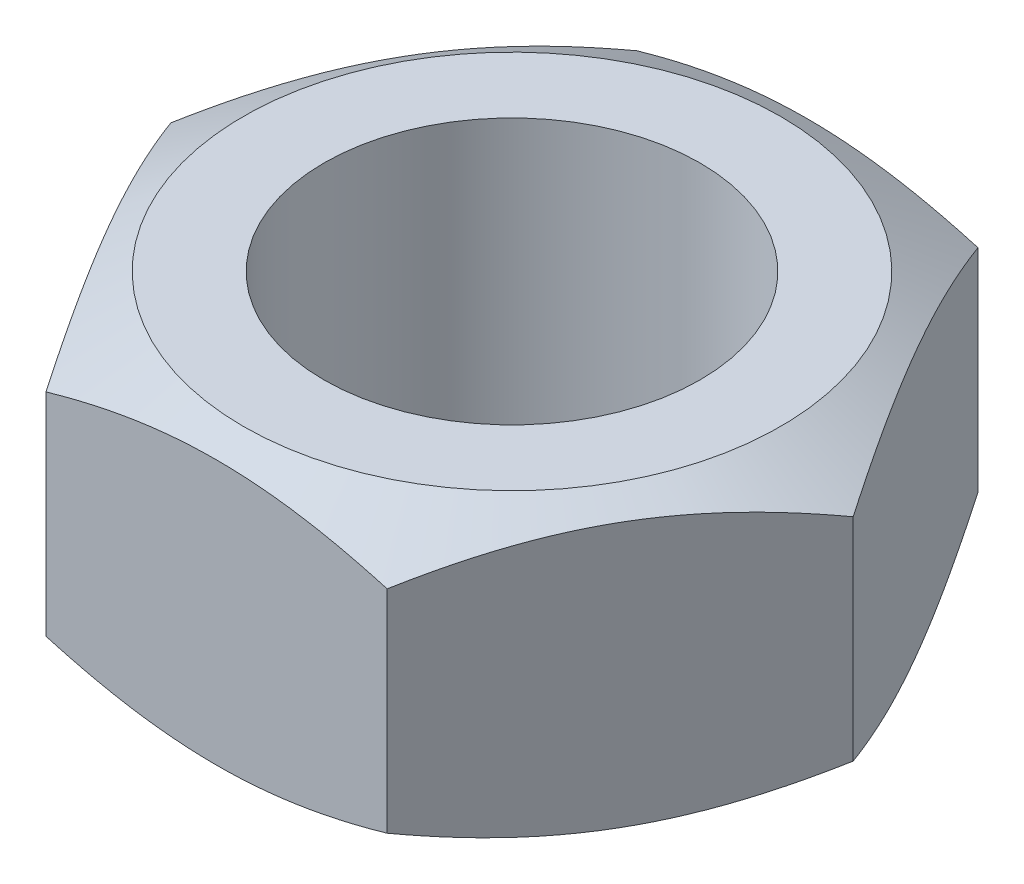
from build123d import *

# Parameters (mm, degrees)
SALIENTE_EXTRUIR6_DEPTH = 5.5
CROQUIS6_R              = 7
CORTAR_EXTRUIR1_DEPTH   = 11
CROQUIS10_OUTSIDE_W     = 69.118
CROQUIS10_OUTSIDE_H     = 65.714
CROQUIS10_OUTSIDE_R     = 10
CORTAR_EXTRUIR2_DEPTH   = 10
CORTAR_EXTRUIR2_DRAFT   = -60
CROQUIS11_OUTSIDE_W     = 69.118
CROQUIS11_OUTSIDE_H     = 65.714
CROQUIS11_OUTSIDE_R     = 10
CORTAR_EXTRUIR3_DEPTH   = 10
CORTAR_EXTRUIR3_DRAFT   = -60


with BuildPart() as part:
    # Croquis5 → Saliente-Extruir6 (new, symmetric)
    with BuildSketch(Plane(origin=(0, 0, 0), x_dir=(1, 0, 0), z_dir=(0, 1, 0))):
        Polygon((12.701705922, 0), (6.350852961, 11), (-6.350852961, 11), (-12.701705922, 0), (-6.350852961, -11), (6.350852961, -11), align=None)
    extrude(amount=SALIENTE_EXTRUIR6_DEPTH, both=True)

    # Croquis6 → Cortar-Extruir1 (cut)
    with BuildSketch(Plane(origin=(0, 5.5, 0), x_dir=(1, 0, 0), z_dir=(0, 1, 0))):
        with Locations(Location((0, 0, 0), (0, 0, 270))):
            Circle(CROQUIS6_R)
    extrude(amount=-CORTAR_EXTRUIR1_DEPTH, mode=Mode.SUBTRACT)


with BuildPart() as cortar_extruir2_tool:
    # Croquis10 outside → Cortar-Extruir2 (with draft: the straight prism first)
    with BuildSketch(Plane(origin=(0, 5.5, 0), x_dir=(1, 0, 0), z_dir=(0, 1, 0))):
        Rectangle(CROQUIS10_OUTSIDE_W, CROQUIS10_OUTSIDE_H)
        Circle(CROQUIS10_OUTSIDE_R, mode=Mode.SUBTRACT)
    extrude(amount=-CORTAR_EXTRUIR2_DEPTH)
    # Cortar-Extruir2: the draft: its side faces are tilted about the plane it starts from
    cortar_extruir2_sides = [cortar_extruir2_tool.faces().sort_by_distance(p)[0] for p in [
        (0, 0.5, 32.857),
        (34.559, 0.5, 0),
        (0, 0.5, -32.857),
        (-34.559, 0.5, 0),
        (-10, 0.5, 0),
    ]]
    draft(cortar_extruir2_sides, Plane(origin=(0, 5.5, 0), x_dir=(1, 0, 0), z_dir=(0, 1, 0)), CORTAR_EXTRUIR2_DRAFT)


with BuildPart() as part_1:
    add(part.part)

    # Cortar-Extruir2: cut by cortar_extruir2_tool
    add(cortar_extruir2_tool.part, mode=Mode.SUBTRACT)


with BuildPart() as cortar_extruir3_tool:
    # Croquis11 outside → Cortar-Extruir3 (with draft: the straight prism first)
    with BuildSketch(Plane.XZ.offset(5.5)):
        Rectangle(CROQUIS11_OUTSIDE_W, CROQUIS11_OUTSIDE_H)
        Circle(CROQUIS11_OUTSIDE_R, mode=Mode.SUBTRACT)
    extrude(amount=-CORTAR_EXTRUIR3_DEPTH)
    # Cortar-Extruir3: the draft: its side faces are tilted about the plane it starts from
    cortar_extruir3_sides = [cortar_extruir3_tool.faces().sort_by_distance(p)[0] for p in [
        (0, -0.5, -32.857),
        (34.559, -0.5, 0),
        (0, -0.5, 32.857),
        (-34.559, -0.5, 0),
        (-10, -0.5, 0),
    ]]
    draft(cortar_extruir3_sides, Plane.XZ.offset(5.5), CORTAR_EXTRUIR3_DRAFT)


with BuildPart() as part_2:
    add(part_1.part)

    # Cortar-Extruir3: cut by cortar_extruir3_tool
    add(cortar_extruir3_tool.part, mode=Mode.SUBTRACT)


solid = part_2.part
